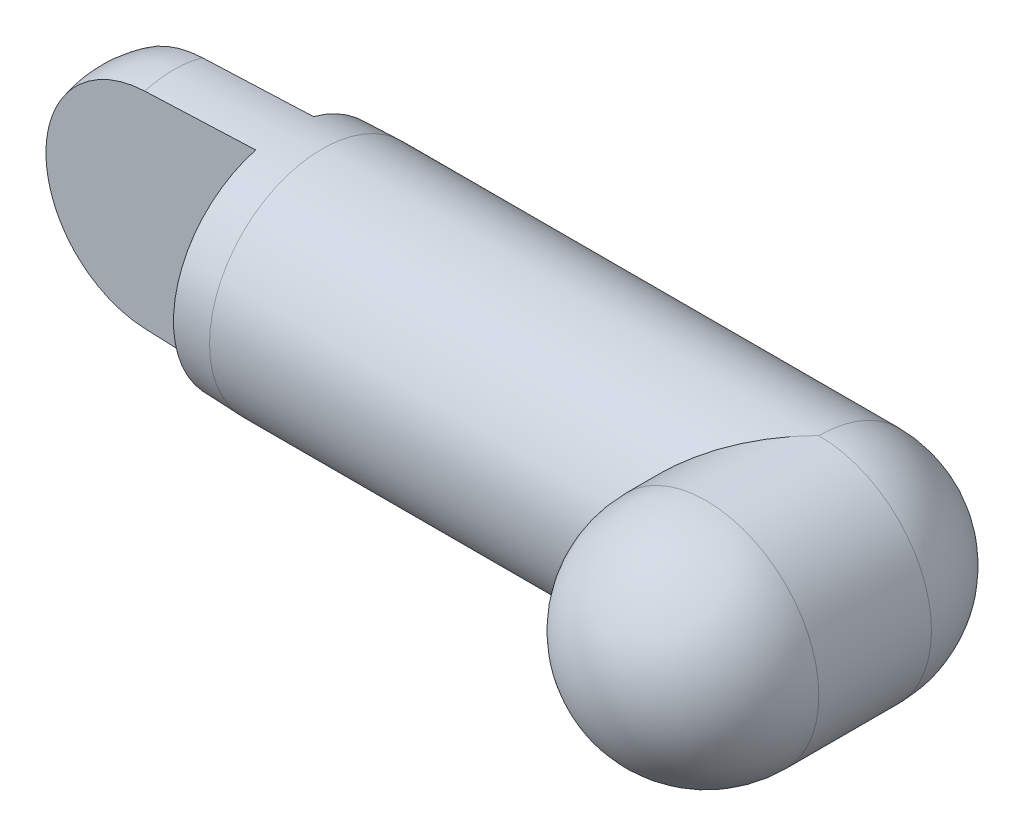
from build123d import *
from build123d.topology import SkipClean

# Parameters (mm, degrees)
CUT_EXTRUDE1_DEPTH      = 285.72070999490006
CUT_EXTRUDE1_DEPTH_BACK = 285.72070999490006
SKETCH13_R              = 49.530000000000044
BOSS_EXTRUDE4_DEPTH     = 49.53


with BuildPart() as part:
    # Sketch1 → Revolve1 (revolve)
    with BuildSketch(Plane.XY, mode=Mode.PRIVATE) as revolve1_sk:
        with BuildLine():
            Line((-57.35114817524302, 46.95352330159362), (8.000000000000007, 49.53))
            Line((8.000000000000007, 49.53), (226.43999999999997, 49.529999999999994))
            ThreePointArc((226.43999999999997, 49.529999999999994), (261.4629988721697, 35.022998872169694), (275.96999999999997, 0))
            Line((275.96999999999997, 0), (-102.49, 0))
            ThreePointArc((-102.49, 0), (-89.37510555522056, 32.56589202866499), (-57.35114817524302, 46.95352330159362))
        make_face()
    revolve(revolve1_sk.sketch.rotate(Axis((-1000, 0, 0), (1, 0, 0)), 90), axis=Axis((-1000, 0, 0), (1, 0, 0)))

    # Sketch2 → Cut-Extrude1 (cut, two sides: drawn at the far end of the back side and taken through both)
    with BuildSketch(Plane(origin=(0, 0, 0), x_dir=(1, 0, 0), z_dir=(0, 1, 0)).offset(-CUT_EXTRUDE1_DEPTH_BACK)):
        Polygon((-102.49, 88.9), (-8.50999999999999, 88.9), (-8.50999999999998, 12.700000000000003), (-102.48999999999998, 12.7), align=None)
        Polygon((-102.48999999999998, -12.7), (-8.50999999999998, -12.700000000000003), (-8.50999999999999, -88.9), (-102.49, -88.9), align=None)
    extrude(amount=CUT_EXTRUDE1_DEPTH + CUT_EXTRUDE1_DEPTH_BACK, mode=Mode.SUBTRACT)

    # Sketch13 → Boss-Extrude4 (add)
    with SkipClean():  # the faces are left unmerged after this step: merging them gives an invalid solid
        with BuildSketch(Plane.XY):
            with Locations((226.43999999999997, 0)):
                Circle(SKETCH13_R)
        extrude(amount=BOSS_EXTRUDE4_DEPTH)

    # Sketch14 → Revolve4 (revolve)
    with SkipClean():  # the faces are left unmerged after this step: merging them gives an invalid solid
        with BuildSketch(Plane.XY.offset(49.53)):
            with BuildLine():
                Line((176.90999999999997, 0), (275.96999999999997, 1.82e-14))
                ThreePointArc((275.96999999999997, 1.82e-14), (226.43999999999997, 49.53), (176.90999999999997, 0))
            make_face()
        revolve(axis=Axis((176.90999999999997, 0, 49.53), (1, 1.8e-16, 0)))


solid = part.part
